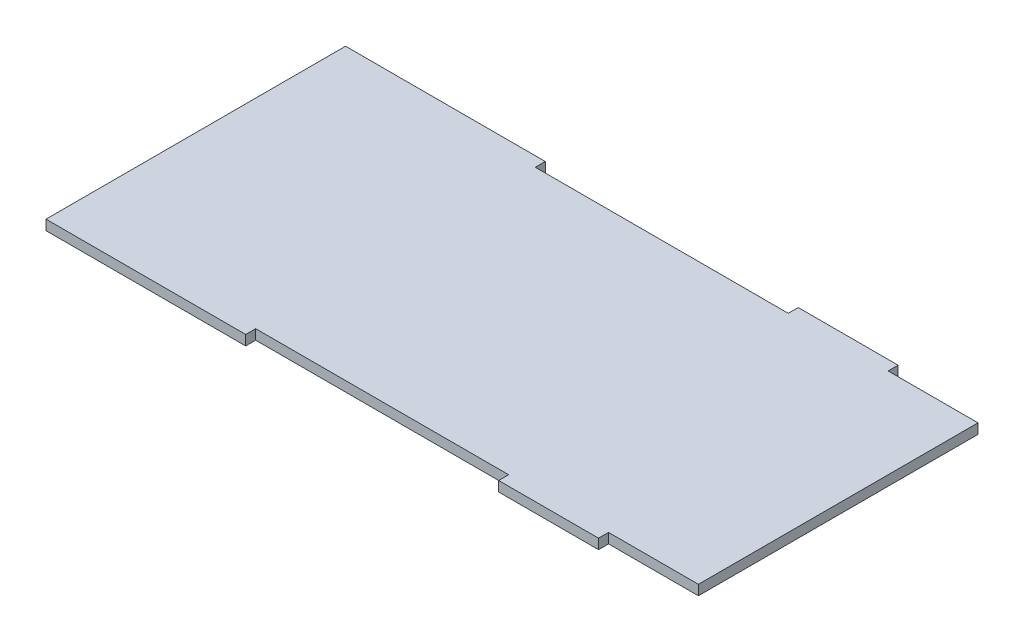
from build123d import *

# Parameters (mm, degrees)
BOSS_EXTRUDE1_DEPTH = 3


with BuildPart() as part:
    # Sketch1 → Boss-Extrude1 (new body)
    with BuildSketch(Plane(origin=(0, 0, 0), x_dir=(1, 0, 0), z_dir=(0, 1, 0))):
        Polygon((68, 45), (38, 45), (38, 42), (-38, 42), (-38, 45), (-98, 45), (-98, -45), (-38, -45), (-38, -42), (38, -42), (38, -45), (68, -45), (68, -42), (95, -42), (95, 42), (68, 42), align=None)
    extrude(amount=BOSS_EXTRUDE1_DEPTH)


solid = part.part
